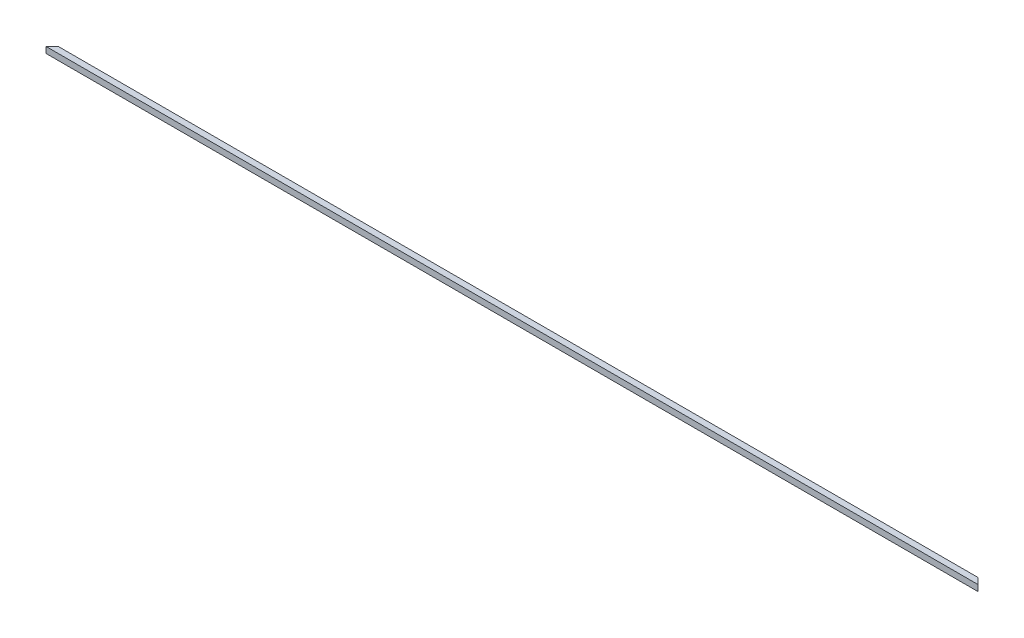
from build123d import *

# Parameters (mm, degrees)
BOSS_EXTRUDE1_DEPTH = 20


with BuildPart() as part:
    # Sketch1 → Boss-Extrude1 (new body)
    with BuildSketch(Plane(origin=(0, 0, 0), x_dir=(1, 0, 0), z_dir=(0, 1, 0))):
        Polygon((0, 0), (3048, 0), (3028, 20), (20, 20), align=None)
    extrude(amount=BOSS_EXTRUDE1_DEPTH)


solid = part.part
